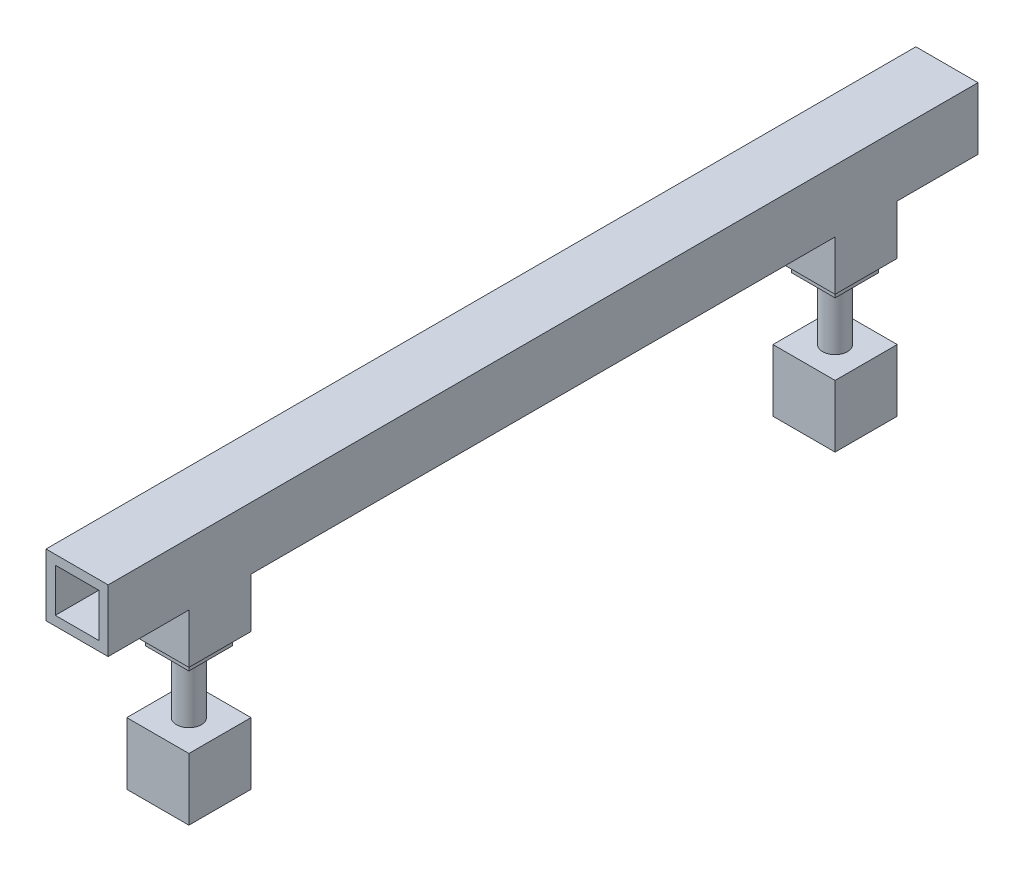
from build123d import *

# Parameters (mm, degrees)
SKETCH_1_W          = 50
SKETCH_1_H          = 50
SKETCH_1_W_2        = 35
SKETCH_1_H_2        = 35
EXTRUDE_1_DEPTH     = 350
SKETCH_2_W          = 50
SKETCH_2_H          = 50
SKETCH_2_W_2        = 35
SKETCH_2_H_2        = 35
EXTRUDE_2_DEPTH     = 40
SKETCH_3_W          = 35
SKETCH_3_H          = 35
CUT_EXTRUDE_1_DEPTH = 70
SKETCH_4_W          = 35
SKETCH_4_H          = 35
SKETCH_4_R          = 10
EXTRUDE_3_DEPTH     = 10
EXTRUDE_3_2_DEPTH   = 10
SKETCH_5_R          = 10
SKETCH_5_R_2        = 5
EXTRUDE_4_DEPTH     = 50
EXTRUDE_4_2_DEPTH   = 50
SKETCH_6_W          = 50
SKETCH_6_H          = 50
SKETCH_6_R          = 10
EXTRUDE_5_DEPTH     = 50
EXTRUDE_5_2_DEPTH   = 50


with BuildPart() as part:
    # Эскиз1 → Бобышка-Вытянуть1 (new, symmetric)
    with BuildSketch(Plane.XY):
        Rectangle(SKETCH_1_W, SKETCH_1_H)
        Rectangle(SKETCH_1_W_2, SKETCH_1_H_2, mode=Mode.SUBTRACT)
    extrude(amount=EXTRUDE_1_DEPTH, both=True)

    # Эскиз2 → Бобышка-Вытянуть2 (add)
    # profile 1 of 2: a face of its own
    with BuildSketch(Plane.XZ.offset(25)):
        with Locations((0, -260)):
            Rectangle(SKETCH_2_W, SKETCH_2_H)
        with Locations((0, -260)):
            Rectangle(SKETCH_2_W_2, SKETCH_2_H_2, mode=Mode.SUBTRACT)
    # profile 2 of 2: a face of its own
    with BuildSketch(Plane.XZ.offset(25)):
        with Locations((0, 260)):
            Rectangle(SKETCH_2_W, SKETCH_2_H)
        with Locations((0, 260)):
            Rectangle(SKETCH_2_W_2, SKETCH_2_H_2, mode=Mode.SUBTRACT)
    extrude(amount=EXTRUDE_2_DEPTH)

    # Эскиз3 → Вырез-Вытянуть1 (cut)
    with BuildSketch(Plane.XZ.offset(65)):
        with Locations((0, 260)):
            Rectangle(SKETCH_3_W, SKETCH_3_H)
        with Locations((0, -260)):
            Rectangle(SKETCH_3_W, SKETCH_3_H)
    extrude(amount=-CUT_EXTRUDE_1_DEPTH, mode=Mode.SUBTRACT)


with BuildPart() as body_2:
    # Эскиз4 → Бобышка-Вытянуть3 (new body)
    with BuildSketch(Plane.XZ.offset(65)):
        with Locations((0, 260)):
            Rectangle(SKETCH_4_W, SKETCH_4_H)
        with Locations(Location((0, 260, 0), (0, 0, 270))):
            Circle(SKETCH_4_R, mode=Mode.SUBTRACT)
    extrude(amount=EXTRUDE_3_DEPTH)


with BuildPart() as body_3:
    # Эскиз4 → Extrude 3 2 (new body)
    with BuildSketch(Plane.XZ.offset(65)):
        with Locations((0, -260)):
            Rectangle(SKETCH_4_W, SKETCH_4_H)
        with Locations(Location((0, -260, 0), (0, 0, 90))):
            Circle(SKETCH_4_R, mode=Mode.SUBTRACT)
    extrude(amount=EXTRUDE_3_2_DEPTH)


with BuildPart() as body_4:
    # Эскиз5 → Бобышка-Вытянуть4 (new body)
    with BuildSketch(Plane.XZ.offset(75)):
        with Locations(Location((0, 260, 0), (0, 0, 270))):
            Circle(SKETCH_5_R)
        with Locations(Location((0, 260, 0), (0, 0, 270))):
            Circle(SKETCH_5_R_2, mode=Mode.SUBTRACT)
    extrude(amount=EXTRUDE_4_DEPTH)


with BuildPart() as body_5:
    # Эскиз5 → Extrude 4 2 (new body)
    with BuildSketch(Plane.XZ.offset(75)):
        with Locations(Location((0, -260, 0), (0, 0, 90))):
            Circle(SKETCH_5_R)
        with Locations(Location((0, -260, 0), (0, 0, 90))):
            Circle(SKETCH_5_R_2, mode=Mode.SUBTRACT)
    extrude(amount=EXTRUDE_4_2_DEPTH)


with BuildPart() as body_6:
    # Эскиз6 → Бобышка-Вытянуть5 (new body)
    with BuildSketch(Plane.XZ.offset(125)):
        with Locations((0, 260)):
            Rectangle(SKETCH_6_W, SKETCH_6_H)
        with Locations(Location((0, 260, 0), (0, 0, 270))):
            Circle(SKETCH_6_R, mode=Mode.SUBTRACT)
    extrude(amount=EXTRUDE_5_DEPTH)


with BuildPart() as body_7:
    # Эскиз6 → Extrude 5 2 (new body)
    with BuildSketch(Plane.XZ.offset(125)):
        with Locations((0, -260)):
            Rectangle(SKETCH_6_W, SKETCH_6_H)
        with Locations(Location((0, -260, 0), (0, 0, 90))):
            Circle(SKETCH_6_R, mode=Mode.SUBTRACT)
    extrude(amount=EXTRUDE_5_2_DEPTH)


solid = Compound([part.part, body_2.part, body_3.part, body_4.part, body_5.part, body_6.part, body_7.part])
